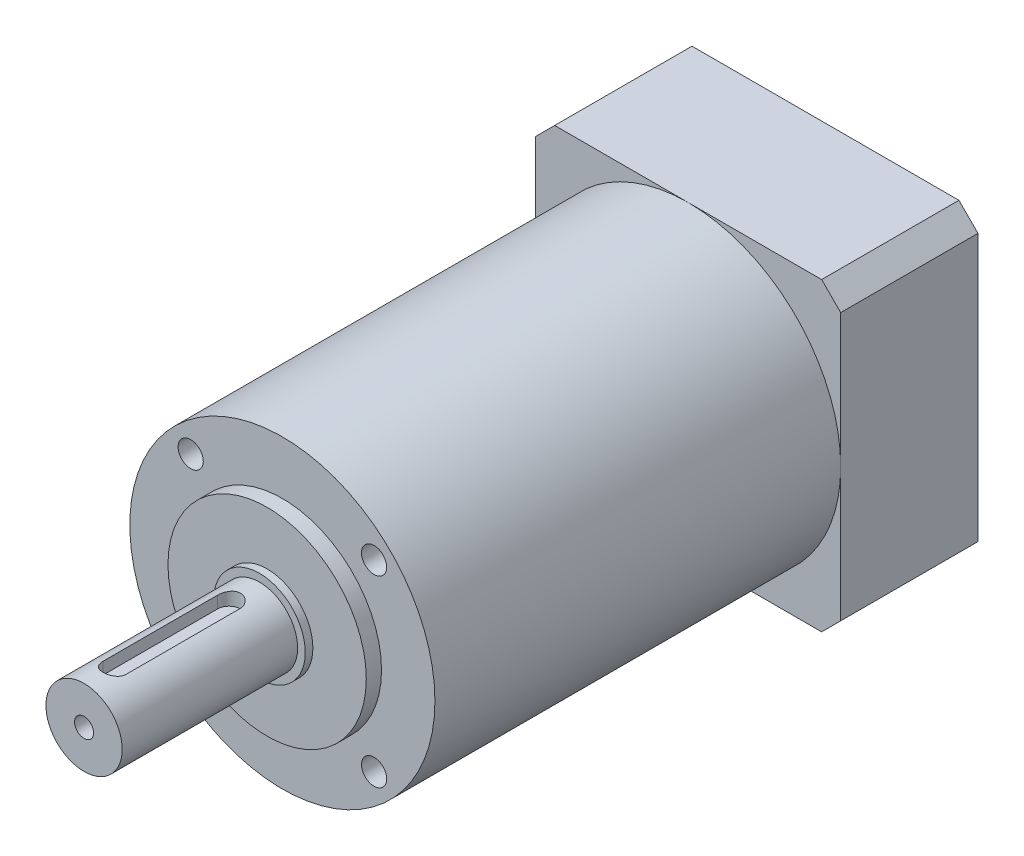
from build123d import *

# Parameters (mm, degrees)
SKETCH_1_W               = 40
SKETCH_1_H               = 40
EXTRUDE_1_DEPTH          = 18
SKETCH_2_R               = 20
EXTRUDE_2_DEPTH          = 53.2
SKETCH_3_R               = 13
EXTRUDE_3_DEPTH          = 2
SKETCH_4_R               = 6
EXTRUDE_4_DEPTH          = 1
SKETCH_5_R               = 5
EXTRUDE_5_DEPTH          = 23
CUT_EXTRUDE_1_DEPTH      = 1.8
HOLE_WIZARD_M31_D        = 2.5
HOLE_WIZARD_M31_DEPTH    = 15
HOLE_WIZARD_M31_TIP      = 0.751075774
PATTERN_CIRCULAR_1_COUNT = 4
CHAMFER_1_SIZE           = 2.5
SKETCH_15_R              = 16.5
CUT_EXTRUDE_2_DEPTH      = 18
EXTRUDE_6_DEPTH          = 15
FILLET_1_R               = 0.5
SKETCH_17_R              = 13.5
SKETCH_17_R_2            = 9
EXTRUDE_7_DEPTH          = 16
FILLET_2_R               = 0.5
PATTERN_CIRCULAR_2_COUNT = 4


with BuildPart() as part:
    # Эскиз1 → Бобышка-Вытянуть1 (new body)
    with BuildSketch(Plane.XY):
        with Locations((20, 20)):
            Rectangle(SKETCH_1_W, SKETCH_1_H)
    extrude(amount=EXTRUDE_1_DEPTH)

    # Эскиз2 → Бобышка-Вытянуть2 (add)
    with BuildSketch(Plane.XY.offset(18)):
        with Locations((20, 20)):
            Circle(SKETCH_2_R)
    extrude(amount=EXTRUDE_2_DEPTH)

    # Эскиз3 → Бобышка-Вытянуть3 (add)
    with BuildSketch(Plane.XY.offset(71.2)):
        with Locations((20, 20)):
            Circle(SKETCH_3_R)
    extrude(amount=EXTRUDE_3_DEPTH)

    # Эскиз4 → Бобышка-Вытянуть4 (add)
    with BuildSketch(Plane.XY.offset(73.2)):
        with Locations((20, 20)):
            Circle(SKETCH_4_R)
    extrude(amount=EXTRUDE_4_DEPTH)

    # Эскиз5 → Бобышка-Вытянуть5 (add)
    with BuildSketch(Plane.XY.offset(74.2)):
        with Locations((20, 20)):
            Circle(SKETCH_5_R)
    extrude(amount=EXTRUDE_5_DEPTH)

    # Эскиз9 → Вырез-Вытянуть1 (cut)
    with BuildSketch(Plane(origin=(0, 25, 0), x_dir=(-1, 0, 0), z_dir=(0, -1, 0))):
        with BuildLine():
            Line((-21.5, -93.2), (-21.5, -78.2))
            ThreePointArc((-21.5, -78.2), (-20, -76.7), (-18.5, -78.2))
            Line((-18.5, -78.2), (-18.5, -93.2))
            ThreePointArc((-18.5, -93.2), (-20, -94.7), (-21.5, -93.2))
        make_face()
    extrude(amount=CUT_EXTRUDE_1_DEPTH, mode=Mode.SUBTRACT)

    # Отверстие обработанное метчиком M31
    with Locations(Plane.XY.offset(97.2)):
        with Locations((20, 20)):
            Hole(HOLE_WIZARD_M31_D / 2, depth=HOLE_WIZARD_M31_DEPTH)
            with Locations((0, 0, -(HOLE_WIZARD_M31_DEPTH + HOLE_WIZARD_M31_TIP / 2))):  # 118° drill point
                Cone(0, HOLE_WIZARD_M31_D / 2, HOLE_WIZARD_M31_TIP, mode=Mode.SUBTRACT)

    # Эскиз14 → Отверстие обработанное метчиком M41 (revolve, cut)
    with BuildSketch(Plane(origin=(7.97918472, 32.02081528, 71.2), x_dir=(0, -1, 0), z_dir=(1, 0, 0))):
        Polygon((0, 0), (0, 7.991420021), (1.65, 7), (1.65, 0), align=None)
    hole_wizard_m41 = revolve(axis=Axis((7.97918472, 32.02081528, 77.55), (0, 0, -1)), mode=Mode.SUBTRACT)

    # Круговой массив1: Отверстие обработанное метчиком M41 ×4 about axis
    pattern_circular_1_axis = Axis((20, 20, 0), (0, 0, 1))
    for i in range(1, PATTERN_CIRCULAR_1_COUNT):
        add(hole_wizard_m41.rotate(pattern_circular_1_axis, i * 360 / PATTERN_CIRCULAR_1_COUNT), mode=Mode.SUBTRACT)

    # Фаска1
    chamfer_1_edges = [part.edges().sort_by_distance(p)[0] for p in [
        (0, 40, 9),
        (40, 40, 9),
        (40, 0, 9),
        (0, 0, 9),
    ]]
    chamfer(chamfer_1_edges, length=CHAMFER_1_SIZE)

    # Эскиз15 → Вырез-Вытянуть2 (cut)
    with BuildSketch(Plane(origin=(0, 0, 0), x_dir=(-1, 0, 0), z_dir=(0, 0, -1))):
        with Locations((-20, 20)):
            Circle(SKETCH_15_R)
    extrude(amount=-CUT_EXTRUDE_2_DEPTH, mode=Mode.SUBTRACT)

    # Эскиз16 → Бобышка-Вытянуть6 (add)
    with BuildSketch(Plane(origin=(0, 0, 18), x_dir=(-1, 0, 0), z_dir=(0, 0, -1))):
        with BuildLine():
            Line((-21, 14.591673087), (-21, 11.05572809))
            ThreePointArc((-21, 11.05572809), (-20, 29), (-19, 11.05572809))
            Line((-19, 11.05572809), (-19, 14.591673087))
            ThreePointArc((-19, 14.591673087), (-20, 25.5), (-21, 14.591673087))
        make_face()
    extrude(amount=EXTRUDE_6_DEPTH)

    # Скругление1
    fillet_1_edges = [part.edges().sort_by_distance(p)[0] for p in [
        (20, 29, 3),
        (20, 25.5, 3),
    ]]
    fillet(fillet_1_edges, radius=FILLET_1_R)

    # Эскиз17 → Бобышка-Вытянуть7 (add)
    with BuildSketch(Plane(origin=(0, 0, 18), x_dir=(-1, 0, 0), z_dir=(0, 0, -1))):
        with Locations((-20, 20)):
            Circle(SKETCH_17_R)
        with Locations(Location((-20, 20, 0), (0, 0, 263.620629792))):
            Circle(SKETCH_17_R_2, mode=Mode.SUBTRACT)
    extrude(amount=EXTRUDE_7_DEPTH)

    # Скругление2
    fillet_2_edges = [part.edges().sort_by_distance(p)[0] for p in [
        (19, 28.94427191, 2),
    ]]
    fillet(fillet_2_edges, radius=FILLET_2_R)

    # Эскиз22 → Отверстие обработанное метчиком M43 (revolve, cut)
    with BuildSketch(Plane(origin=(36.3, 36.3, 0), x_dir=(0, 1, 0), z_dir=(1, 0, 0))):
        Polygon((0, 0), (0, 12.491420021), (1.65, 11.5), (1.65, 0), align=None)
    hole_wizard_m43 = revolve(axis=Axis((36.3, 36.3, -6.35), (0, 0, 1)), mode=Mode.SUBTRACT)

    # Круговой массив2: Отверстие обработанное метчиком M43 ×4 about axis
    pattern_circular_2_axis = Axis((20, 20, 0), (0, 0, 1))
    for i in range(1, PATTERN_CIRCULAR_2_COUNT):
        add(hole_wizard_m43.rotate(pattern_circular_2_axis, i * 360 / PATTERN_CIRCULAR_2_COUNT), mode=Mode.SUBTRACT)


solid = part.part
